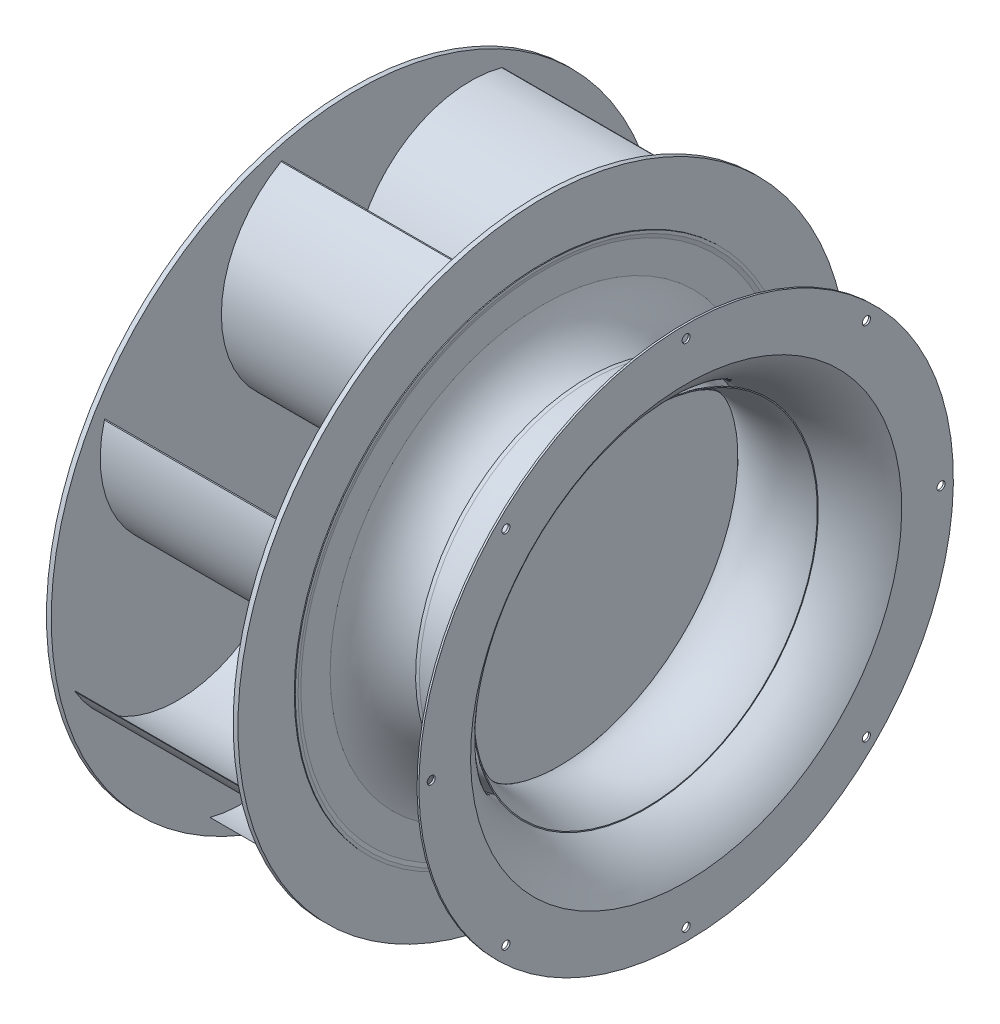
from build123d import *

# Parameters (mm, degrees)
SKETCH2_R         = 322
EXTRUDE1_DEPTH    = 5
SKETCH9_R         = 317
SKETCH9_R_2       = 100
EXTRUDE7_DEPTH    = 3
SKETCH3_R         = 322
EXTRUDE2_DEPTH    = 5
EXTRUDE3_DEPTH    = 197
CIRPATTERN1_COUNT = 8
SKETCH7_R         = 4.25
EXTRUDE5_DEPTH    = 5
CIRPATTERN2_COUNT = 8
SKETCH8_R         = 5
EXTRUDE6_DEPTH    = 90
CIRPATTERN3_COUNT = 8


with BuildPart() as part:
    # Sketch1 → Revolve1 (revolve)
    with BuildSketch(Plane.XY, mode=Mode.PRIVATE) as revolve1_sk:
        with BuildLine():
            Line((0, 0), (0, 109))
            ThreePointArc((0, 109), (1.464466094, 112.535533906), (5, 114))
            Line((5, 114), (70, 114))
            Line((70, 114), (70, 138))
            Line((70, 138), (90, 138))
            Line((90, 138), (90, 98))
            Line((90, 98), (95, 98))
            Line((95, 98), (95, 133))
            Line((95, 133), (105, 133))
            Line((105, 133), (105, 98))
            Line((105, 98), (129, 98))
            Line((129, 98), (129, 0))
            Line((129, 0), (0, 0))
        make_face()
    revolve(revolve1_sk.sketch.rotate(Axis((0, 0, 0), (1, 0, 0)), 90), axis=Axis((0, 0, 0), (1, 0, 0)))

    # Sketch2 → Extrude1 (add)
    with BuildSketch(Plane(origin=(129, 0, 0), x_dir=(0, 0, -1), z_dir=(1, 0, 0))):
        Circle(SKETCH2_R)
    extrude(amount=EXTRUDE1_DEPTH)

    # Sketch9 → Extrude7 (cut)
    with BuildSketch(Plane.ZY.offset(-129)):
        Circle(SKETCH9_R)
        Circle(SKETCH9_R_2, mode=Mode.SUBTRACT)
    extrude(amount=-EXTRUDE7_DEPTH, mode=Mode.SUBTRACT)



with BuildPart() as body_2:
    # Sketch3 → Extrude2 (new body)
    with BuildSketch(Plane(origin=(326, 0, 0), x_dir=(0, 0, -1), z_dir=(1, 0, 0))):
        Circle(SKETCH3_R)
    extrude(amount=EXTRUDE2_DEPTH)


with BuildPart() as part_1:
    add(part.part)

    add(body_2.part)  # Extrude3 merges body 2
    # Sketch4 → Extrude3 (add)
    with BuildSketch(Plane(origin=(134, 0, 0), x_dir=(0, 0, -1), z_dir=(1, 0, 0))):
        with BuildLine():
            Line((0, 112.5), (0.866025404, 112))
            ThreePointArc((0.866025404, 112), (33.143390798, 233.195288477), (154.366025404, 265.369798962))
            Line((154.366025404, 265.369798962), (153.5, 265.869798962))
            ThreePointArc((153.5, 265.869798962), (32.277365394, 233.695288477), (0, 112.5))
        make_face()
    extrude3 = extrude(amount=EXTRUDE3_DEPTH)

    # CirPattern1: Extrude3 ×8 about axis
    cirpattern1_axis = Axis((0, 0, 0), (1, 0, 0))
    for i in range(1, CIRPATTERN1_COUNT):
        add(extrude3.rotate(cirpattern1_axis, i * 360 / CIRPATTERN1_COUNT))

    # Sketch5 → Revolve2 (revolve)
    with BuildSketch(Plane.XY, mode=Mode.PRIVATE) as revolve2_sk:
        with BuildLine():
            Line((331, 262.5), (332, 262.5))
            Line((332, 262.5), (332, 259.5))
            ThreePointArc((332, 259.5), (358.37945443, 183.313008104), (439, 182.5))
            Line((439, 182.5), (439, 181.5))
            ThreePointArc((439, 181.5), (356.613916044, 181.196191446), (331, 259.5))
            Line((331, 259.5), (331, 262.5))
        make_face()
    revolve(revolve2_sk.sketch.rotate(Axis((0, 0, 0), (1, 0, 0)), 90), axis=Axis((0, 0, 0), (1, 0, 0)))

    # Sketch8 → Extrude6 (cut)
    with BuildSketch(Plane(origin=(0, 0, 0), x_dir=(0, 0, -1), z_dir=(1, 0, 0))):
        with Locations(Location((0, 126, 0), (0, 0, 180))):
            Circle(SKETCH8_R)
    extrude6 = extrude(amount=EXTRUDE6_DEPTH, mode=Mode.SUBTRACT)

    # CirPattern3: Extrude6 ×8 about axis
    cirpattern3_axis = Axis((0, 0, 0), (1, 0, 0))
    for i in range(1, CIRPATTERN3_COUNT):
        add(extrude6.rotate(cirpattern3_axis, i * 360 / CIRPATTERN3_COUNT), mode=Mode.SUBTRACT)


with BuildPart() as body_2_2:
    # Sketch6 → Revolve3 (revolve)
    with BuildSketch(Plane.XY, mode=Mode.PRIVATE) as revolve3_sk:
        with BuildLine():
            Line((482, 282), (480, 282))
            Line((480, 282), (480, 227.5))
            ThreePointArc((480, 227.5), (437.763122811, 190.091607925), (382, 181.5))
            Line((382, 181.5), (378, 181.5))
            Line((378, 181.5), (378, 179.5))
            Line((378, 179.5), (382, 179.5))
            ThreePointArc((382, 179.5), (439.265305263, 188.363947369), (482, 227.5))
            Line((482, 227.5), (482, 282))
        make_face()
    revolve(revolve3_sk.sketch.rotate(Axis((0, 0, 0), (1, 0, 0)), 180), axis=Axis((0, 0, 0), (1, 0, 0)))

    # Sketch7 → Extrude5 (cut)
    with BuildSketch(Plane(origin=(482, 0, 0), x_dir=(0, 0, -1), z_dir=(1, 0, 0))):
        with Locations((0, 269)):
            Circle(SKETCH7_R)
    extrude5 = extrude(amount=-EXTRUDE5_DEPTH, mode=Mode.SUBTRACT)

    # CirPattern2: Extrude5 ×8 about axis
    cirpattern2_axis = Axis((0, 0, 0), (1, 0, 0))
    for i in range(1, CIRPATTERN2_COUNT):
        add(extrude5.rotate(cirpattern2_axis, i * 360 / CIRPATTERN2_COUNT), mode=Mode.SUBTRACT)


solid = Compound([part_1.part, body_2_2.part])
